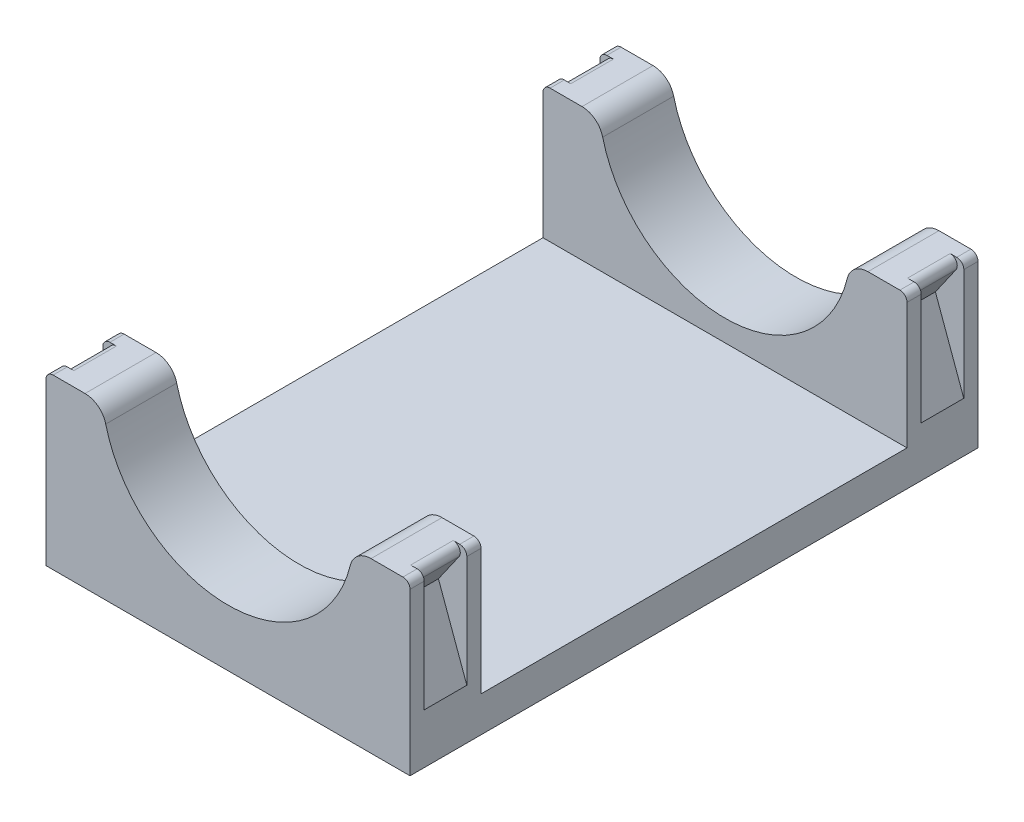
from build123d import *

# Parameters (mm, degrees)
BOSS_EXTRUDE1_DEPTH = 5
CUT_EXTRUDE1_DEPTH  = 3
FILLET2_R           = 1
FILLET3_R           = 1
FILLET4_R           = 3
LPATTERN1_COUNT     = 2
LPATTERN1_PITCH     = 70
BOSS_EXTRUDE2_REACH = 80.869
SKETCH3_W           = 51.273928048
SKETCH3_H           = 5


with BuildPart() as part:
    # Sketch1 → Boss-Extrude1 (new, symmetric)
    with BuildSketch(Plane.XY):
        with BuildLine():
            Line((25.636964024, -25.75), (25.636964024, -2))
            Line((25.636964024, -2), (17.636964024, -2))
            ThreePointArc((17.636964024, -2), (0, -17.75), (-17.636964024, -2))
            Line((-17.636964024, -2), (-25.636964024, -2))
            Line((-25.636964024, -2), (-25.636964024, -25.75))
            Line((-25.636964024, -25.75), (25.636964024, -25.75))
        make_face()
    extrude(amount=BOSS_EXTRUDE1_DEPTH, both=True)

    # Sketch2 → Cut-Extrude1 (cut, symmetric)
    with BuildSketch(Plane.XY):
        Polygon((25.636964024, -2), (21.636964024, -7.712592027), (25.636964024, -18.702501705), align=None)
    cut_extrude1 = extrude(amount=CUT_EXTRUDE1_DEPTH, both=True, mode=Mode.SUBTRACT)

    # Mirror4: Cut-Extrude1 across plane
    add(cut_extrude1.mirror(Plane(origin=(0, 0, 0), x_dir=(0, 0, 1), z_dir=(1, 0, 0))), mode=Mode.SUBTRACT)

    # Fillet2
    fillet2_edges = [part.edges().sort_by_distance(p)[0] for p in [
        (25.636964024, -2, 0),
        (-25.636964024, -2, 0),
    ]]
    fillet(fillet2_edges, radius=FILLET2_R)

    # Fillet3
    fillet3_edges = [part.edges().sort_by_distance(p)[0] for p in [
        (25.636964024, -2, 4),
        (-25.636964024, -2, 4),
        (25.636964024, -2, -4),
        (-25.636964024, -2, -4),
    ]]
    fillet(fillet3_edges, radius=FILLET3_R)

    # Fillet4
    fillet4_edges = [part.edges().sort_by_distance(p)[0] for p in [
        (-17.636964024, -2, 0),
        (17.636964024, -2, 0),
    ]]
    fillet(fillet4_edges, radius=FILLET4_R)


with BuildPart() as lpattern1_1:
    # LPattern1: pattern copy
    add(part.part.moved(Location(Vector(0, 0, 1) * (1 * LPATTERN1_PITCH))))

    # Sketch3 → Boss-Extrude2 (add, up to next)
    with BuildSketch(Plane.XY.offset(5), mode=Mode.PRIVATE) as boss_extrude2_sk1:
        with Locations((0, -23.25)):
            Rectangle(SKETCH3_W, SKETCH3_H)
    boss_extrude2_tool1 = extrude(boss_extrude2_sk1.sketch, amount=BOSS_EXTRUDE2_REACH, mode=Mode.PRIVATE) - lpattern1_1.part

    add(part.part)  # Boss-Extrude2 merges part
    add(boss_extrude2_tool1.solids().sort_by_distance((0, -23.25, 5))[0])


solid = lpattern1_1.part
